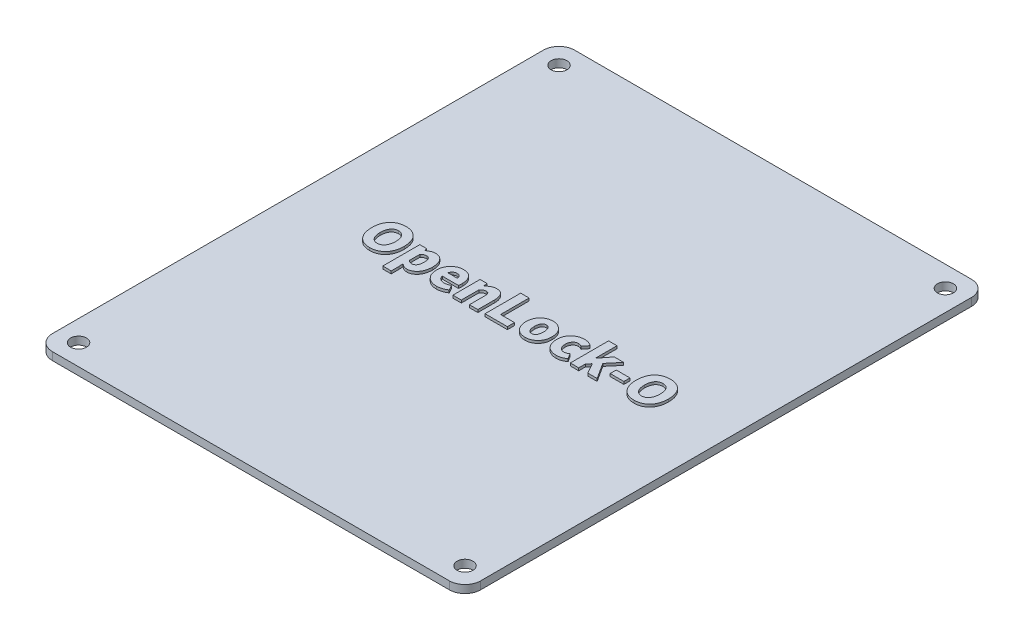
from build123d import *

# Parameters (mm, degrees)
SKETCH_1_W      = 82
SKETCH_1_H      = 100
SKETCH_1_R      = 1.525
EXTRUDE_1_DEPTH = 1.5
SKETCH_2_W      = 2.623961311
SKETCH_2_H      = 1.170362286
EXTRUDE_2_DEPTH = 0.5
FILLET_1_R      = 3


with BuildPart() as part:
    # 草图1 → 凸台-拉伸1 (new body)
    with BuildSketch(Plane(origin=(0, 0, 0), x_dir=(1, 0, 0), z_dir=(0, 1, 0))):
        with Locations((41, -50)):
            Rectangle(SKETCH_1_W, SKETCH_1_H)
        with Locations(Location((78, -4, 0), (0, 0, 270))):
            Circle(SKETCH_1_R, mode=Mode.SUBTRACT)
        with Locations(Location((4, -4, 0), (0, 0, 270))):
            Circle(SKETCH_1_R, mode=Mode.SUBTRACT)
        with Locations(Location((4, -96, 0), (0, 0, 270))):
            Circle(SKETCH_1_R, mode=Mode.SUBTRACT)
        with Locations(Location((78, -96, 0), (0, 0, 270))):
            Circle(SKETCH_1_R, mode=Mode.SUBTRACT)
    extrude(amount=EXTRUDE_1_DEPTH)

    # 草图2 → 凸台-拉伸2 (add)
    # profile 1 of 10: a face of its own
    with BuildSketch(Plane(origin=(0, 1.5, 0), x_dir=(1, 0, 0), z_dir=(0, 1, 0))):
        with BuildLine():
            add(Edge.make_bspline(
                [(16.597531244, -52.868504696), (16.714143345, -52.864361155), (16.942726236, -52.856238992), (17.275370336, -52.808965248), (17.589702335, -52.734304407), (17.885026024, -52.630618307), (18.160325946, -52.494980051), (18.418914493, -52.335556389), (18.655600222, -52.142759502), (18.873261107, -51.924148646), (19.068114571, -51.679209336), (19.238948607, -51.411578768), (19.383528015, -51.121239837), (19.502193704, -50.808702049), (19.595657136, -50.474187206), (19.663502929, -50.11760401), (19.704634315, -49.738677208), (19.712469256, -49.478656133), (19.716484597, -49.345397497)],
                knots=[0, 0, 0, 0, 1.05465202, 2.067327541, 3.032428974, 3.972491955, 4.891096316, 5.802957447, 6.713715081, 7.644945694, 8.587773863, 9.538525278, 10.511118449, 11.515624505, 12.557315148, 13.648110402, 14.794676162, 16, 16, 16, 16], degree=3))
            add(Edge.make_bspline(
                [(19.716484597, -49.345397497), (19.712509077, -49.21257955), (19.704778914, -48.954322999), (19.663352207, -48.578096697), (19.595879049, -48.224980662), (19.502127894, -47.894084131), (19.38384762, -47.585784092), (19.238822569, -47.300506498), (19.068410927, -47.038308031), (18.873101319, -46.799845129), (18.655121937, -46.587813456), (18.418310651, -46.400732379), (18.160584927, -46.244722235), (17.884169592, -46.115571579), (17.589674812, -46.013633924), (17.275093378, -45.942401469), (16.942469396, -45.895885552), (16.713696689, -45.888735374), (16.596858011, -45.885083639)],
                knots=[0, 0, 0, 0, 1.211229518, 2.355163325, 3.446999469, 4.485577954, 5.487016047, 6.45314753, 7.398105733, 8.332941379, 9.257579319, 10.165753545, 11.078753583, 11.997945354, 12.943095481, 13.914308117, 14.934796524, 16, 16, 16, 16], degree=3))
            add(Edge.make_bspline(
                [(16.596858011, -45.885083639), (16.480043441, -45.888880754), (16.252260152, -45.896284962), (15.919694191, -45.94057514), (15.606596769, -46.014010129), (15.311694106, -46.114240078), (15.03610472, -46.242538299), (14.780834839, -46.400913786), (14.542088581, -46.583924843), (14.32669681, -46.797844958), (14.129891678, -47.033845874), (13.962005671, -47.297067037), (13.816112702, -47.581394203), (13.699770938, -47.89079444), (13.605953905, -48.22187404), (13.538256519, -48.575860006), (13.496977234, -48.952992689), (13.489231024, -49.212135368), (13.485247595, -49.345397497)],
                knots=[0, 0, 0, 0, 1.066056328, 2.078763097, 3.055634584, 3.996376676, 4.916304394, 5.823104597, 6.732714334, 7.65518785, 8.58763338, 9.531136451, 10.498041464, 11.498821944, 12.542141308, 13.634851627, 14.783740645, 16, 16, 16, 16], degree=3))
            add(Edge.make_bspline(
                [(13.485247595, -49.345397497), (13.489259396, -49.478657542), (13.497087427, -49.738681367), (13.538267905, -50.117588633), (13.605940374, -50.474240802), (13.699966928, -50.808362107), (13.81641854, -51.121609118), (13.961821636, -51.411075622), (14.130630075, -51.679722437), (14.326017567, -51.923503608), (14.542077279, -52.143819205), (14.779799048, -52.334150428), (15.036360247, -52.495909528), (15.31113974, -52.630114029), (15.606053308, -52.734880558), (15.919798062, -52.808409731), (16.252057495, -52.856516232), (16.480008537, -52.864441924), (16.597531244, -52.868504696)],
                knots=[0, 0, 0, 0, 1.206525496, 2.354234335, 3.446117067, 4.488846234, 5.492922286, 6.466485093, 7.416021675, 8.359789805, 9.28911132, 10.203917972, 11.109861039, 12.029381212, 12.966582716, 13.936566544, 14.94226799, 16, 16, 16, 16], degree=3))
        make_face()
        with BuildLine():
            add(Edge.make_bspline(
                [(16.597531244, -51.44162624), (16.540160998, -51.439525749), (16.427991061, -51.435418883), (16.265631292, -51.404756325), (16.113284985, -51.359293865), (15.969760107, -51.29799214), (15.837271664, -51.216594997), (15.713138647, -51.119769236), (15.598988196, -51.005494071), (15.496630017, -50.873772074), (15.404287414, -50.727980222), (15.324484943, -50.568399029), (15.255713598, -50.395997599), (15.200578025, -50.210686758), (15.156127637, -50.012533335), (15.12434272, -49.801835802), (15.106108081, -49.577734241), (15.102407463, -49.424255453), (15.100506072, -49.345397497)],
                knots=[0, 0, 0, 0, 0.952337426, 1.862004026, 2.734839039, 3.589527261, 4.445782341, 5.309892407, 6.199028993, 7.120883171, 8.075078566, 9.060831922, 10.079986027, 11.154028263, 12.268395546, 13.450470468, 14.690042507, 16, 16, 16, 16], degree=3))
            add(Edge.make_bspline(
                [(15.100506072, -49.345397497), (15.102410881, -49.266987077), (15.106106825, -49.114845587), (15.124142818, -48.89336284), (15.156586741, -48.685473347), (15.199621794, -48.490939988), (15.25633729, -48.310071703), (15.324153148, -48.142654393), (15.404017781, -47.988302069), (15.496679402, -47.848874798), (15.599432938, -47.723642503), (15.713708405, -47.615062573), (15.836957345, -47.521800715), (15.970697162, -47.446654461), (16.113331597, -47.38743339), (16.26580825, -47.344809309), (16.427976812, -47.317247406), (16.53974005, -47.31374966), (16.596858011, -47.311962095)],
                knots=[0, 0, 0, 0, 1.324004878, 2.568996251, 3.748233199, 4.873607961, 5.929399441, 6.94440958, 7.91962876, 8.857982539, 9.765748034, 10.64851045, 11.513124996, 12.368273394, 13.231153703, 14.114140207, 15.036208426, 16, 16, 16, 16], degree=3))
            add(Edge.make_bspline(
                [(16.596858011, -47.311962095), (16.653977669, -47.313741255), (16.765744227, -47.317222554), (16.928312804, -47.344974398), (17.081670889, -47.38746402), (17.225391062, -47.446321733), (17.359400334, -47.521848107), (17.482742479, -47.615002712), (17.59693391, -47.724037386), (17.701106615, -47.84875348), (17.794907431, -47.988297207), (17.876591117, -48.142266117), (17.943599851, -48.310377053), (18.002554181, -48.490647038), (18.045112151, -48.685510883), (18.077190413, -48.893427006), (18.097434663, -49.114767657), (18.100818592, -49.266973832), (18.102562149, -49.345397497)],
                knots=[0, 0, 0, 0, 0.962011429, 1.882376567, 2.770955087, 3.639177498, 4.492746418, 5.355764002, 6.236895936, 7.147789007, 8.08857927, 9.065491182, 10.078626575, 11.134736751, 12.258032921, 13.435091792, 14.678440589, 16, 16, 16, 16], degree=3))
            add(Edge.make_bspline(
                [(18.102562149, -49.345397497), (18.100820537, -49.424268468), (18.097430041, -49.57781111), (18.076985613, -49.801771472), (18.045573265, -50.012498062), (18.001588422, -50.210966464), (17.944221294, -50.395701967), (17.876264506, -50.568777536), (17.794635156, -50.727980266), (17.701163321, -50.873894082), (17.597359073, -51.005103448), (17.483313901, -51.11982789), (17.359084693, -51.216547175), (17.226342131, -51.298339992), (17.081714611, -51.3592633), (16.928483535, -51.404579305), (16.765951788, -51.435401327), (16.654004764, -51.439522475), (16.597531244, -51.44162624)],
                knots=[0, 0, 0, 0, 1.307924065, 2.546210755, 3.726450759, 4.839088226, 5.913622602, 6.931194688, 7.918764782, 8.875449427, 9.800453563, 10.688209955, 11.550978676, 12.405904603, 13.266045869, 14.144600545, 15.052855082, 16, 16, 16, 16], degree=3))
        make_face(mode=Mode.SUBTRACT)
    # profile 2 of 10: a face of its own
    with BuildSketch(Plane(origin=(0, 1.5, 0), x_dir=(1, 0, 0), z_dir=(0, 1, 0))):
        with BuildLine():
            Line((20.9255891, -54.672144498), (22.539512853, -54.672144498))
            Line((22.539512853, -54.672144498), (22.539512853, -53.151776664))
            Line((22.539512853, -53.151776664), (22.485021417, -52.327105234))
            add(Edge.make_bspline(
                [(22.485021417, -52.327105234), (22.530979605, -52.369890065), (22.621160552, -52.453844127), (22.766001077, -52.563530263), (22.915310785, -52.656701193), (23.069337675, -52.732975697), (23.228062315, -52.793731126), (23.39134572, -52.837977079), (23.559348262, -52.865249693), (23.672812583, -52.870081262), (23.729914262, -52.872512781)],
                knots=[0, 0, 0, 0, 1.080819245, 2.120825615, 3.123218811, 4.10761128, 5.076191243, 6.04549969, 7.016384644, 8, 8, 8, 8], degree=3))
            add(Edge.make_bspline(
                [(23.729914262, -52.872512781), (23.800878877, -52.869726108), (23.941048596, -52.864221855), (24.14686745, -52.827012759), (24.34531306, -52.767655141), (24.536236739, -52.68608958), (24.720229034, -52.582065516), (24.895022561, -52.454241453), (25.062951342, -52.304568651), (25.22253035, -52.134465887), (25.370214562, -51.943664844), (25.498428607, -51.731298402), (25.607788759, -51.499966714), (25.700525584, -51.250841904), (25.772245198, -50.981829243), (25.824455603, -50.694012596), (25.861905283, -50.387526147), (25.869172789, -50.176521107), (25.872904003, -50.068188925)],
                knots=[0, 0, 0, 0, 0.867524246, 1.713538924, 2.549096929, 3.395672208, 4.246701567, 5.1278759, 6.038181227, 6.993591226, 7.976008708, 8.982739347, 10.02033566, 11.100620423, 12.228692567, 13.419536219, 14.675163049, 16, 16, 16, 16], degree=3))
            add(Edge.make_bspline(
                [(25.872904003, -50.068188925), (25.870412402, -49.971502122), (25.865569925, -49.783589402), (25.840718084, -49.509354766), (25.797447489, -49.251574831), (25.741303693, -49.008442153), (25.665694196, -48.781660005), (25.57569493, -48.570048526), (25.467767681, -48.374757519), (25.345380989, -48.196054635), (25.209348742, -48.034744785), (25.058813442, -47.894470577), (24.894436632, -47.776533495), (24.718614895, -47.677965071), (24.529457964, -47.601578886), (24.328322976, -47.545577783), (24.114137448, -47.50999834), (23.96697663, -47.504496964), (23.891573712, -47.501678144)],
                knots=[0, 0, 0, 0, 1.272678031, 2.473474996, 3.620070239, 4.710417113, 5.753870283, 6.762012236, 7.73260534, 8.685248579, 9.608297554, 10.504075368, 11.385706603, 12.264645351, 13.150571421, 14.063517403, 15.0077764, 16, 16, 16, 16], degree=3))
            add(Edge.make_bspline(
                [(23.891573712, -47.501678144), (23.821983793, -47.504280809), (23.683422313, -47.509463012), (23.478225884, -47.542218846), (23.278200948, -47.595871965), (23.084448106, -47.670415152), (22.897243961, -47.759606954), (22.71720087, -47.861647798), (22.545196834, -47.976311477), (22.438207152, -48.063273), (22.384533545, -48.106899062)],
                knots=[0, 0, 0, 0, 1.008046353, 2.007135434, 3.0023849, 4.002826844, 5.009902542, 6.003708328, 6.998518635, 8, 8, 8, 8], degree=3))
            Line((22.384533545, -48.106899062), (22.358090879, -48.105602175))
            Line((22.358090879, -48.105602175), (22.240226809, -47.58584794))
            Line((22.240226809, -47.58584794), (20.9255891, -47.58584794))
            Line((20.9255891, -47.58584794), (20.9255891, -54.672144498))
        make_face()
        with BuildLine():
            add(Edge.make_bspline(
                [(23.333755712, -51.523679788), (23.301010071, -51.524744686), (23.235096165, -51.526888224), (23.136275514, -51.515389051), (23.037424366, -51.493689081), (22.938222709, -51.461167657), (22.837955286, -51.418486524), (22.738048048, -51.364268243), (22.636587414, -51.301855815), (22.572468456, -51.252099301), (22.539512853, -51.226525649)],
                knots=[0, 0, 0, 0, 0.905667419, 1.823023605, 2.744097981, 3.702908016, 4.707896946, 5.75551274, 6.846387504, 8, 8, 8, 8], degree=3))
            Line((22.539512853, -51.226525649), (22.539512853, -49.199005826))
            add(Edge.make_bspline(
                [(22.539512853, -49.199005826), (22.572773243, -49.164792007), (22.637334213, -49.098380358), (22.741399797, -49.011576384), (22.844949437, -48.93591118), (22.95100915, -48.875012367), (23.059076362, -48.829762482), (23.167442002, -48.795316173), (23.278093215, -48.776195737), (23.352195798, -48.774449791), (23.38922699, -48.773577292)],
                knots=[0, 0, 0, 0, 1.169019233, 2.269156072, 3.31747539, 4.31007895, 5.259096192, 6.184586201, 7.092785528, 8, 8, 8, 8], degree=3))
            add(Edge.make_bspline(
                [(23.38922699, -48.773577292), (23.424895805, -48.774225823), (23.494276368, -48.775487301), (23.59474363, -48.788703461), (23.688526673, -48.812352867), (23.774233436, -48.84928096), (23.854105713, -48.894765033), (23.926923229, -48.951100223), (23.991305834, -49.019573238), (24.050731402, -49.096819515), (24.100681893, -49.186030162), (24.145991113, -49.284327449), (24.180290047, -49.39434818), (24.212324336, -49.513884808), (24.233765447, -49.644614189), (24.249774929, -49.785497881), (24.259521132, -49.936676768), (24.259165357, -50.041008951), (24.258981554, -50.094909495)],
                knots=[0, 0, 0, 0, 0.949516528, 1.846935277, 2.692706436, 3.516571434, 4.324226536, 5.135617785, 5.957687961, 6.821154133, 7.724432043, 8.674615029, 9.698551362, 10.788825593, 11.968525099, 13.221996814, 14.564815966, 16, 16, 16, 16], degree=3))
            add(Edge.make_bspline(
                [(24.258981554, -50.094909495), (24.257225396, -50.156381775), (24.253849123, -50.274564262), (24.241395922, -50.445577368), (24.21796928, -50.602821301), (24.190041376, -50.748005172), (24.150636588, -50.878996607), (24.105917691, -50.997557377), (24.052480004, -51.102634061), (23.99069483, -51.194441921), (23.921872991, -51.272675674), (23.851000514, -51.342473011), (23.774555323, -51.399474035), (23.694830625, -51.447417238), (23.610457355, -51.483912736), (23.521150764, -51.50719503), (23.428535809, -51.522949471), (23.365246815, -51.52395134), (23.333113792, -51.524460008)],
                knots=[0, 0, 0, 0, 1.543295769, 2.967037079, 4.299417015, 5.531209635, 6.673402462, 7.727741312, 8.707409226, 9.624928412, 10.496510736, 11.318533489, 12.116500839, 12.883175602, 13.649198431, 14.413752374, 15.194632004, 16, 16, 16, 16], degree=3))
            Line((23.333113792, -51.524460008), (23.333755712, -51.523679788))
        make_face(mode=Mode.SUBTRACT)
    # profile 3 of 10: a face of its own
    with BuildSketch(Plane(origin=(0, 1.5, 0), x_dir=(1, 0, 0), z_dir=(0, 1, 0))):
        with BuildLine():
            add(Edge.make_bspline(
                [(29.400573791, -52.868536009), (29.478416697, -52.866798654), (29.635722314, -52.863287791), (29.872647958, -52.832117826), (30.11236375, -52.783978657), (30.352792601, -52.717664307), (30.589359165, -52.633002206), (30.817371031, -52.529298794), (31.036479165, -52.409598224), (31.173670808, -52.315680062), (31.242402612, -52.268627892)],
                knots=[0, 0, 0, 0, 0.949363525, 1.91848201, 2.910541743, 3.930827625, 4.958594776, 5.972611383, 6.984296177, 8, 8, 8, 8], degree=3))
            Line((31.242402612, -52.268627892), (30.739934551, -51.304824226))
            add(Edge.make_bspline(
                [(30.739934551, -51.304824226), (30.647441805, -51.351785154), (30.467454154, -51.443169479), (30.185706948, -51.54013899), (29.904020848, -51.600093492), (29.715157853, -51.60848824), (29.621800021, -51.61263789)],
                knots=[0, 0, 0, 0, 1.061643805, 2.065921734, 3.043955894, 4, 4, 4, 4], degree=3))
            add(Edge.make_bspline(
                [(29.621800021, -51.61263789), (29.54950802, -51.61202599), (29.407054294, -51.61082022), (29.197334805, -51.573264489), (28.997786265, -51.508394571), (28.83847157, -51.434354065), (28.721406379, -51.355792577), (28.637380959, -51.288095305), (28.562690324, -51.206654313), (28.494703584, -51.115511374), (28.432388421, -51.014285397), (28.378242451, -50.901660887), (28.329748851, -50.77844886), (28.304239988, -50.691450256), (28.291115618, -50.646689272)],
                knots=[0, 0, 0, 0, 1.44726418, 2.851880876, 4.249415211, 5.646949545, 6.355106443, 7.071821608, 7.804538447, 8.563385163, 9.348862513, 10.183343221, 11.065325871, 12, 12, 12, 12], degree=3))
            Line((28.291115618, -50.646689272), (31.360209275, -50.645354549))
            add(Edge.make_bspline(
                [(31.360209275, -50.645354549), (31.364709113, -50.626677913), (31.374630648, -50.585498456), (31.387808245, -50.517807929), (31.399731971, -50.438460561), (31.413892874, -50.314733559), (31.428202392, -50.144644531), (31.42990171, -50.004542546), (31.430782633, -49.931914016)],
                knots=[0, 0, 0, 0, 0.481247852, 1.061086476, 1.726960091, 2.490863857, 4.180872323, 6, 6, 6, 6], degree=3))
            add(Edge.make_bspline(
                [(31.430782633, -49.931914016), (31.42939768, -49.848570712), (31.426680263, -49.685042694), (31.400717847, -49.444676097), (31.357798546, -49.214811527), (31.300271654, -48.994611417), (31.221130863, -48.786616177), (31.128095155, -48.587284231), (31.015430898, -48.399427206), (30.887375206, -48.222296749), (30.7422378, -48.05957152), (30.57693406, -47.917246869), (30.393361837, -47.796479987), (30.192814095, -47.695204056), (29.973487278, -47.617187339), (29.736883966, -47.558162167), (29.482169956, -47.520932482), (29.306173966, -47.512629216), (29.215647352, -47.508358286)],
                knots=[0, 0, 0, 0, 1.079232204, 2.11756307, 3.126740041, 4.106201248, 5.060837545, 6.005223805, 6.951950163, 7.893442881, 8.832848148, 9.769468829, 10.710183717, 11.672405636, 12.67234138, 13.718811886, 14.82663102, 16, 16, 16, 16], degree=3))
            add(Edge.make_bspline(
                [(29.215647352, -47.508358286), (29.134463352, -47.511689088), (28.974438058, -47.518254575), (28.738508936, -47.555234336), (28.510862837, -47.61416983), (28.290634182, -47.694604705), (28.078429014, -47.797177241), (27.873560414, -47.919944253), (27.67737894, -48.066092737), (27.490201272, -48.231176177), (27.318436407, -48.41617158), (27.165814604, -48.617990459), (27.036448491, -48.836033788), (26.928987472, -49.069989584), (26.841341123, -49.318316947), (26.780226569, -49.583822546), (26.735634386, -49.86372501), (26.726139836, -50.056434327), (26.721282111, -50.155030778)],
                knots=[0, 0, 0, 0, 0.964800247, 1.90175952, 2.8309468, 3.754997237, 4.682736995, 5.627419143, 6.588366425, 7.585435191, 8.588886157, 9.582621669, 10.586295836, 11.594854022, 12.637429717, 13.709100714, 14.827900274, 16, 16, 16, 16], degree=3))
            add(Edge.make_bspline(
                [(26.721282111, -50.155030778), (26.725319041, -50.259373921), (26.733180604, -50.462572906), (26.773851569, -50.757632602), (26.836278313, -51.034549101), (26.921672164, -51.29391614), (27.03059408, -51.535372019), (27.159920423, -51.760570995), (27.314762556, -51.965652129), (27.490587516, -52.151220499), (27.682220358, -52.318205672), (27.889410402, -52.463209211), (28.109621879, -52.586686014), (28.342686638, -52.688575796), (28.589030342, -52.767525495), (28.847994118, -52.824510142), (29.119731555, -52.861720649), (29.305484198, -52.867101996), (29.400019287, -52.869840724)],
                knots=[0, 0, 0, 0, 1.169002523, 2.276528382, 3.330470668, 4.344713422, 5.329280848, 6.29260664, 7.24731909, 8.200048858, 9.151197353, 10.089427384, 11.027392192, 11.974490578, 12.933571255, 13.919868197, 14.941358559, 16, 16, 16, 16], degree=3))
            Line((29.400019287, -52.869840724), (29.400573791, -52.868536009))
        make_face()
        with BuildLine():
            add(Edge.make_bspline(
                [(28.283165988, -49.560498088), (28.303230868, -49.491984153), (28.341299099, -49.36199562), (28.429416906, -49.188773407), (28.535155833, -49.04470408), (28.664609831, -48.937942724), (28.803473339, -48.859578993), (28.946124176, -48.80220343), (29.093370088, -48.768527692), (29.19276874, -48.766548648), (29.242367922, -48.765561121)],
                knots=[0, 0, 0, 0, 1.262493809, 2.395275001, 3.425824592, 4.4058338, 5.34247459, 6.242157035, 7.122849544, 8, 8, 8, 8], degree=3))
            add(Edge.make_bspline(
                [(29.242367922, -48.765561121), (29.278459091, -48.766957813), (29.347674194, -48.769636369), (29.447926993, -48.779693285), (29.539956817, -48.798546832), (29.62469415, -48.823561124), (29.70103083, -48.855915113), (29.770636527, -48.893410383), (29.83225446, -48.938431929), (29.901248303, -49.009035918), (29.974341044, -49.108208956), (30.034211051, -49.245615478), (30.070167388, -49.398319553), (30.07228042, -49.505067029), (30.07337766, -49.560498088)],
                knots=[0, 0, 0, 0, 0.990336762, 1.899252999, 2.759015381, 3.562565422, 4.317804928, 5.028279135, 5.726793959, 6.400310994, 7.729065746, 9.079306386, 10.483363283, 12, 12, 12, 12], degree=3))
            Line((30.07337766, -49.560498088), (28.283165988, -49.560498088))
        make_face(mode=Mode.SUBTRACT)
    # profile 4 of 10: a face of its own
    with BuildSketch(Plane(origin=(0, 1.5, 0), x_dir=(1, 0, 0), z_dir=(0, 1, 0))):
        with BuildLine():
            Line((32.468875485, -52.791016347), (34.082799238, -52.791016347))
            Line((34.082799238, -52.791016347), (34.082799238, -49.391371752))
            add(Edge.make_bspline(
                [(34.082799238, -49.391371752), (34.120811872, -49.356579393), (34.194536646, -49.289100279), (34.305664085, -49.196844617), (34.415075211, -49.119050048), (34.521047662, -49.051381756), (34.631875264, -48.998644519), (34.750476496, -48.963622526), (34.876753303, -48.93937691), (34.964011903, -48.937522021), (35.008667, -48.936572771)],
                knots=[0, 0, 0, 0, 1.165579364, 2.260618836, 3.264174379, 4.200621562, 5.101895524, 6.029141078, 6.991401432, 8, 8, 8, 8], degree=3))
            add(Edge.make_bspline(
                [(35.008667, -48.936572771), (35.058299392, -48.937177914), (35.15222409, -48.938323092), (35.283842713, -48.97180928), (35.395500265, -49.032004722), (35.469924815, -49.105595162), (35.517387114, -49.177858284), (35.547602643, -49.242988651), (35.574981209, -49.317363596), (35.595517559, -49.402608563), (35.611011275, -49.497798174), (35.623376408, -49.602526041), (35.629472555, -49.717632331), (35.630644632, -49.797860409), (35.631256289, -49.839728048)],
                knots=[0, 0, 0, 0, 1.403580501, 2.656145923, 3.808961022, 4.960738452, 5.580592332, 6.252646208, 6.991589465, 7.824551574, 8.73374269, 9.725139103, 10.812846341, 12, 12, 12, 12], degree=3))
            Line((35.631256289, -49.839728048), (35.632589708, -52.791016347))
            Line((35.632589708, -52.791016347), (37.246513461, -52.791016347))
            Line((37.246513461, -52.791016347), (37.246513461, -49.64187188))
            add(Edge.make_bspline(
                [(37.246513461, -49.64187188), (37.244905553, -49.562178851), (37.241766586, -49.406601652), (37.226838604, -49.179411547), (37.197276039, -48.96522651), (37.156130464, -48.764283894), (37.103128616, -48.575837803), (37.03584571, -48.401106679), (36.959014745, -48.237838601), (36.867682378, -48.089452421), (36.765303035, -47.954140988), (36.646505497, -47.836785609), (36.513130091, -47.737598243), (36.36625534, -47.654727093), (36.204172924, -47.593006908), (36.029410579, -47.545329285), (35.839609587, -47.517991814), (35.708382989, -47.512520223), (35.640608489, -47.509694315)],
                knots=[0, 0, 0, 0, 1.260933832, 2.461602438, 3.599444639, 4.678560811, 5.70436123, 6.692226558, 7.63757411, 8.554672072, 9.443851072, 10.315667569, 11.186458667, 12.066463542, 12.974423475, 13.922916079, 14.927250078, 16, 16, 16, 16], degree=3))
            add(Edge.make_bspline(
                [(35.640608489, -47.509694315), (35.552665938, -47.513884065), (35.380527847, -47.522085049), (35.130396697, -47.568813429), (34.894247551, -47.640154765), (34.67510029, -47.741965294), (34.470783337, -47.864044175), (34.276678985, -47.996891045), (34.094951094, -48.144583672), (33.983592536, -48.253002875), (33.92781993, -48.30730334)],
                knots=[0, 0, 0, 0, 1.087709998, 2.129075413, 3.137726551, 4.130922467, 5.108542943, 6.0786259, 7.037702697, 8, 8, 8, 8], degree=3))
            Line((33.92781993, -48.30730334), (33.901377264, -48.306281747))
            Line((33.901377264, -48.306281747), (33.783513194, -47.58584794))
            Line((33.783513194, -47.58584794), (32.468875485, -47.58584794))
            Line((32.468875485, -47.58584794), (32.468875485, -52.791016347))
        make_face()
    # profile 5 of 10: a face of its own
    with BuildSketch(Plane(origin=(0, 1.5, 0), x_dir=(1, 0, 0), z_dir=(0, 1, 0))):
        Polygon((38.625294891, -52.791015042), (42.917303462, -52.791015042), (42.917303462, -51.433610069), (40.239218644, -51.433610069), (40.239218644, -45.961238569), (38.625294891, -45.961238569), align=None)
    # profile 6 of 10: a face of its own
    with BuildSketch(Plane(origin=(0, 1.5, 0), x_dir=(1, 0, 0), z_dir=(0, 1, 0))):
        with BuildLine():
            add(Edge.make_bspline(
                [(46.362870123, -52.876520867), (46.446973099, -52.874281083), (46.612557499, -52.86987133), (46.855747023, -52.832819004), (47.090416821, -52.779902941), (47.314619526, -52.700331112), (47.531074615, -52.604048845), (47.735844717, -52.481483102), (47.933619364, -52.341720893), (48.118574128, -52.178388811), (48.290023336, -51.996417626), (48.440480861, -51.793469698), (48.568168498, -51.570880396), (48.673243234, -51.329556562), (48.757847722, -51.06964302), (48.81999356, -50.791434823), (48.860494095, -50.494153067), (48.869392234, -50.289652982), (48.873970948, -50.184423406)],
                knots=[0, 0, 0, 0, 0.978512426, 1.926523886, 2.858364272, 3.774892385, 4.691376507, 5.611650703, 6.54820959, 7.507046474, 8.479079749, 9.453763952, 10.440847561, 11.459964718, 12.512516309, 13.618062107, 14.774326603, 16, 16, 16, 16], degree=3))
            add(Edge.make_bspline(
                [(48.873970948, -50.184423406), (48.86939245, -50.079638884), (48.860495688, -49.876025588), (48.820002633, -49.580069544), (48.757832123, -49.303205767), (48.673312898, -49.044566588), (48.567755078, -48.804413427), (48.440967684, -48.582136413), (48.289453491, -48.380468159), (48.119177834, -48.198221704), (47.932617334, -48.036893135), (47.736821754, -47.894739698), (47.530196992, -47.774949099), (47.315336661, -47.675691372), (47.090053176, -47.598845877), (46.855807818, -47.545221035), (46.612332715, -47.508336704), (46.446546532, -47.503922799), (46.362237336, -47.501678144)],
                knots=[0, 0, 0, 0, 1.222736421, 2.375974912, 3.478482595, 4.528028199, 5.544260463, 6.53315431, 7.505459279, 8.479275191, 9.436452288, 10.377757152, 11.297096539, 12.217418416, 13.133936475, 14.067485788, 15.017235832, 16, 16, 16, 16], degree=3))
            add(Edge.make_bspline(
                [(46.362237336, -47.501678144), (46.277484267, -47.503924703), (46.110814299, -47.508342644), (45.86599774, -47.545205044), (45.630460196, -47.598903775), (45.404098557, -47.675335749), (45.188736344, -47.775379735), (44.981109513, -47.894235624), (44.785143127, -48.037390734), (44.597320788, -48.197735372), (44.426965305, -48.380480259), (44.275707554, -48.582508324), (44.147084198, -48.803998452), (44.041940259, -49.044629165), (43.957149685, -49.303173529), (43.895561848, -49.580196098), (43.852814167, -49.875896964), (43.844231188, -50.079615954), (43.839815496, -50.184423406)],
                knots=[0, 0, 0, 0, 0.985978059, 1.938961419, 2.875692889, 3.795286697, 4.713769531, 5.635756143, 6.575180033, 7.534360194, 8.506230167, 9.476592217, 10.466106599, 11.480308165, 12.527756503, 13.628061088, 14.779706926, 16, 16, 16, 16], degree=3))
            add(Edge.make_bspline(
                [(43.839815496, -50.184423406), (43.844231421, -50.289675809), (43.852815755, -50.494281122), (43.895571229, -50.791308753), (43.95713386, -51.069675296), (44.042010547, -51.329493643), (44.146668682, -51.571296572), (44.276196526, -51.793096316), (44.426396209, -51.996405211), (44.597922613, -52.178873498), (44.784141898, -52.341226879), (44.982085289, -52.481984481), (45.187860508, -52.603620541), (45.404814286, -52.700685691), (45.630097511, -52.779847321), (45.86605843, -52.832834234), (46.1107984, -52.869898214), (46.277478907, -52.874288414), (46.362870123, -52.876520867)],
                knots=[0, 0, 0, 0, 1.223044497, 2.377536223, 3.480710779, 4.531004793, 5.547936085, 6.535494004, 7.508087645, 8.478036043, 9.438710516, 10.373260614, 11.296023719, 12.210542111, 13.129992916, 14.064872285, 15.015971412, 16, 16, 16, 16], degree=3))
        make_face()
        with BuildLine():
            add(Edge.make_bspline(
                [(46.362870123, -51.604621719), (46.324721173, -51.602812051), (46.251289439, -51.599328678), (46.144726494, -51.580119045), (46.046308379, -51.549886432), (45.955076681, -51.507704309), (45.871536911, -51.454607406), (45.79742034, -51.386917741), (45.728971495, -51.310229966), (45.670410115, -51.220340932), (45.618510331, -51.121940033), (45.574469088, -51.013912428), (45.537133386, -50.89730163), (45.506754324, -50.771775082), (45.482789629, -50.637479664), (45.465291702, -50.494344479), (45.456333295, -50.342193987), (45.455500622, -50.237874934), (45.455073973, -50.184423406)],
                knots=[0, 0, 0, 0, 0.963941433, 1.855461068, 2.727242465, 3.557761025, 4.387822293, 5.21651017, 6.085383197, 6.977754197, 7.918791909, 8.892352547, 9.920540075, 11.009231951, 12.152307905, 13.364905709, 14.649816963, 16, 16, 16, 16], degree=3))
            add(Edge.make_bspline(
                [(45.455073973, -50.184423406), (45.455500633, -50.131417189), (45.456333159, -50.027987977), (45.465286138, -49.877169828), (45.482792701, -49.735370773), (45.506721071, -49.60239912), (45.537327222, -49.47782264), (45.574519597, -49.361649005), (45.618121929, -49.25381604), (45.670880829, -49.156353705), (45.728479597, -49.066655685), (45.797900886, -48.991258889), (45.87147517, -48.923538001), (45.955093217, -48.870508999), (46.046303712, -48.828308771), (46.144727772, -48.798080101), (46.251081485, -48.778911376), (46.324300148, -48.7753978), (46.362237336, -48.773577292)],
                knots=[0, 0, 0, 0, 1.345604455, 2.625631839, 3.833047409, 4.970692096, 6.053828503, 7.087137873, 8.065548233, 9.001286548, 9.898102829, 10.762845839, 11.595661765, 12.429857923, 13.264513651, 14.140637763, 15.03659844, 16, 16, 16, 16], degree=3))
            add(Edge.make_bspline(
                [(46.362237336, -48.773577292), (46.399269375, -48.775475017), (46.47156671, -48.77917993), (46.576350659, -48.797581704), (46.673478535, -48.828973587), (46.763892459, -48.870033012), (46.846377463, -48.924082511), (46.920014016, -48.990741836), (46.987734353, -49.067227302), (47.046016834, -49.155866959), (47.096334537, -49.254560186), (47.142475116, -49.361229133), (47.178857926, -49.477914681), (47.210213776, -49.602223713), (47.231818897, -49.73554342), (47.249987997, -49.877141947), (47.258748156, -50.027995543), (47.259607894, -50.131419753), (47.260048499, -50.184423406)],
                knots=[0, 0, 0, 0, 0.944623835, 1.844181136, 2.702168957, 3.540175215, 4.368204393, 5.204363464, 6.065050309, 6.96546665, 7.899665974, 8.88638837, 9.923845719, 11.011330124, 12.151565718, 13.363828175, 14.64899393, 16, 16, 16, 16], degree=3))
            add(Edge.make_bspline(
                [(47.260048499, -50.184423406), (47.259607919, -50.237872396), (47.258748057, -50.342186497), (47.249982397, -50.494372098), (47.23182153, -50.637308585), (47.210182111, -50.7719493), (47.17905149, -50.897209651), (47.142523645, -51.014330538), (47.09594099, -51.121199317), (47.046488253, -51.220822033), (46.987239061, -51.309664273), (46.920498421, -51.387430516), (46.846316337, -51.454064521), (46.763908973, -51.508180042), (46.673473978, -51.549221549), (46.57635195, -51.580618405), (46.471566362, -51.599018784), (46.399269256, -51.602723893), (46.362870123, -51.604621719)],
                knots=[0, 0, 0, 0, 1.356015766, 2.646477778, 3.864313948, 5.010380312, 6.103775286, 7.136404538, 8.118534946, 9.058423216, 9.954649218, 10.819856495, 11.652124266, 12.476299979, 13.310406341, 14.164401276, 15.059772236, 16, 16, 16, 16], degree=3))
        make_face(mode=Mode.SUBTRACT)
    # profile 7 of 10: a face of its own
    with BuildSketch(Plane(origin=(0, 1.5, 0), x_dir=(1, 0, 0), z_dir=(0, 1, 0))):
        with BuildLine():
            add(Edge.make_bspline(
                [(52.324627303, -52.876520867), (52.404110708, -52.874444283), (52.562229696, -52.870313265), (52.796765993, -52.837743832), (53.027099343, -52.789821813), (53.249580781, -52.71791807), (53.463157382, -52.630729799), (53.663698171, -52.525553505), (53.853123037, -52.407981008), (53.966555836, -52.314051679), (54.023024851, -52.267291863)],
                knots=[0, 0, 0, 0, 1.035336762, 2.059629965, 3.080613543, 4.097382841, 5.101788831, 6.082924094, 7.045642972, 8, 8, 8, 8], degree=3))
            Line((54.023024851, -52.267291863), (53.386626455, -51.283779168))
            add(Edge.make_bspline(
                [(53.386626455, -51.283779168), (53.352388955, -51.309283338), (53.284939833, -51.359527482), (53.179028462, -51.425315867), (53.070815651, -51.480267053), (52.959652814, -51.524447381), (52.846569088, -51.561114459), (52.730201225, -51.586240878), (52.611241268, -51.60133973), (52.531170621, -51.603518017), (52.490600143, -51.604621719)],
                knots=[0, 0, 0, 0, 1.056047964, 2.080452898, 3.080869373, 4.054901861, 5.037684156, 6.018982631, 6.996251116, 8, 8, 8, 8], degree=3))
            add(Edge.make_bspline(
                [(52.490600143, -51.604621719), (52.449561498, -51.60274009), (52.369298637, -51.599060023), (52.251835838, -51.580219254), (52.140871943, -51.549348287), (52.035306621, -51.507804943), (51.935873306, -51.453798321), (51.841900414, -51.388248263), (51.755044872, -51.310108295), (51.674587335, -51.221403847), (51.601491906, -51.123049067), (51.53695128, -51.015277387), (51.481636323, -50.898706942), (51.438768852, -50.77229608), (51.401431908, -50.63834345), (51.377599862, -50.494523916), (51.358948381, -50.342544368), (51.356320078, -50.237927098), (51.354975903, -50.184423406)],
                knots=[0, 0, 0, 0, 0.967519725, 1.892262816, 2.796107441, 3.676934939, 4.559698254, 5.456386629, 6.370589628, 7.306636836, 8.274213473, 9.253274597, 10.262576824, 11.308056568, 12.395057679, 13.535505222, 14.739600344, 16, 16, 16, 16], degree=3))
            add(Edge.make_bspline(
                [(51.354975903, -50.184423406), (51.356484056, -50.131383599), (51.359431102, -50.027739713), (51.375781701, -49.876877017), (51.400341093, -49.734558449), (51.436958849, -49.601557124), (51.482257465, -49.476743977), (51.536939944, -49.360293457), (51.601026597, -49.252229964), (51.676500126, -49.154997697), (51.758669068, -49.066618149), (51.849304198, -48.98961334), (51.946878602, -48.923927068), (52.051498268, -48.870410755), (52.162712102, -48.828619749), (52.280823405, -48.797692921), (52.406321255, -48.779273361), (52.492323633, -48.775496484), (52.536025112, -48.773577292)],
                knots=[0, 0, 0, 0, 1.229881608, 2.403283825, 3.515287334, 4.574900912, 5.597386342, 6.590511984, 7.553881213, 8.503931974, 9.438993645, 10.347332081, 11.25520085, 12.160364296, 13.065586639, 14.004801253, 14.986154341, 16, 16, 16, 16], degree=3))
            add(Edge.make_bspline(
                [(52.536025112, -48.773577292), (52.600472317, -48.777125047), (52.725245751, -48.783993703), (52.902812702, -48.830988331), (53.064674771, -48.903716963), (53.155869784, -48.975551735), (53.201367313, -49.011390368)],
                knots=[0, 0, 0, 0, 1.071534521, 2.074551428, 3.039386586, 4, 4, 4, 4], degree=3))
            Line((53.201367313, -49.011390368), (53.968417295, -48.039111271))
            add(Edge.make_bspline(
                [(53.968417295, -48.039111271), (53.919993419, -47.999447871), (53.822343574, -47.919464088), (53.662645255, -47.8129165), (53.48751094, -47.722990244), (53.300964813, -47.643452904), (53.101004637, -47.580741786), (52.889098445, -47.535174935), (52.665380865, -47.508845127), (52.512488956, -47.504099338), (52.434486945, -47.501678144)],
                knots=[0, 0, 0, 0, 0.904164879, 1.823306315, 2.767383419, 3.745010637, 4.750389761, 5.790387894, 6.87270562, 8, 8, 8, 8], degree=3))
            add(Edge.make_bspline(
                [(52.434486945, -47.501678144), (52.342621079, -47.503928944), (52.162225523, -47.508348804), (51.897807889, -47.544917912), (51.644162395, -47.598952803), (51.400846001, -47.674987254), (51.169384268, -47.774975396), (50.947062042, -47.893722402), (50.737726213, -48.036446924), (50.538978945, -48.19710693), (50.359349081, -48.380316056), (50.198340515, -48.581410481), (50.062994325, -48.803450284), (49.952746767, -49.044434899), (49.861784174, -49.302532243), (49.797963669, -49.58002504), (49.754060658, -49.87583866), (49.744589282, -50.079608791), (49.739717427, -50.184423406)],
                knots=[0, 0, 0, 0, 1.033326452, 2.029126887, 2.998305124, 3.94927728, 4.892227008, 5.831721402, 6.781041588, 7.739051988, 8.702929585, 9.662459224, 10.63194836, 11.620725557, 12.639809013, 13.705829454, 14.819932049, 16, 16, 16, 16], degree=3))
            add(Edge.make_bspline(
                [(49.739717427, -50.184423406), (49.743204519, -50.289670135), (49.749980811, -50.494190845), (49.790672104, -50.790985016), (49.847198959, -51.069766974), (49.930306843, -51.329023097), (50.030293532, -51.571182964), (50.156194692, -51.792463268), (50.300663232, -51.996677948), (50.468572745, -52.179014508), (50.652436401, -52.342287583), (50.852115958, -52.482894109), (51.063744449, -52.604883649), (51.290976876, -52.701110542), (51.529665091, -52.780187111), (51.782921673, -52.833469758), (52.048664881, -52.869843119), (52.230838346, -52.874267885), (52.323596578, -52.876520867)],
                knots=[0, 0, 0, 0, 1.200198759, 2.332286282, 3.412102103, 4.440150241, 5.432524932, 6.394514518, 7.337423147, 8.27936005, 9.214894099, 10.136551978, 11.060097198, 11.995107192, 12.945957363, 13.923257596, 14.94257403, 16, 16, 16, 16], degree=3))
            Line((52.323596578, -52.876520867), (52.324627303, -52.876520867))
        make_face()
    # profile 8 of 10: a face of its own
    with BuildSketch(Plane(origin=(0, 1.5, 0), x_dir=(1, 0, 0), z_dir=(0, 1, 0))):
        Polygon((54.95690748, -52.791016347), (56.570831233, -52.791016347), (56.570831233, -51.501238684), (57.180326398, -50.815186736), (58.316203752, -52.791016347), (60.098515373, -52.791016347), (58.140743023, -49.754093056), (59.96922852, -47.58584794), (58.168447349, -47.58584794), (56.617005109, -49.543703792), (56.570831233, -49.543703792), (56.570831233, -45.461849636), (54.95690748, -45.461849636), align=None)
    # profile 9 of 10: a face of its own
    with BuildSketch(Plane(origin=(0, 1.5, 0), x_dir=(1, 0, 0), z_dir=(0, 1, 0))):
        with Locations((61.834782937, -50.145679231)):
            Rectangle(SKETCH_2_W, SKETCH_2_H)
    # profile 10 of 10: a face of its own
    with BuildSketch(Plane(origin=(0, 1.5, 0), x_dir=(1, 0, 0), z_dir=(0, 1, 0))):
        with BuildLine():
            add(Edge.make_bspline(
                [(67.216979688, -52.868504696), (67.333591789, -52.864361155), (67.56217468, -52.856238992), (67.894818779, -52.808965248), (68.209150778, -52.734304407), (68.504474468, -52.630618307), (68.77977439, -52.494980051), (69.038362937, -52.335556389), (69.275048666, -52.142759502), (69.492709551, -51.924148646), (69.687563015, -51.679209336), (69.85839705, -51.411578768), (70.002976459, -51.121239837), (70.121642147, -50.808702049), (70.21510558, -50.474187206), (70.282951373, -50.11760401), (70.324082759, -49.738677208), (70.331917699, -49.478656133), (70.335933041, -49.345397497)],
                knots=[0, 0, 0, 0, 1.05465202, 2.067327541, 3.032428974, 3.972491955, 4.891096316, 5.802957447, 6.713715081, 7.644945694, 8.587773863, 9.538525278, 10.511118449, 11.515624505, 12.557315148, 13.648110402, 14.794676162, 16, 16, 16, 16], degree=3))
            add(Edge.make_bspline(
                [(70.335933041, -49.345397497), (70.33195752, -49.21257955), (70.324227358, -48.954322999), (70.28280065, -48.578096697), (70.215327492, -48.224980662), (70.121576337, -47.894084131), (70.003296064, -47.585784092), (69.858271013, -47.300506498), (69.68785937, -47.038308031), (69.492549763, -46.799845129), (69.274570381, -46.587813456), (69.037759094, -46.400732379), (68.780033371, -46.244722235), (68.503618036, -46.115571579), (68.209123256, -46.013633924), (67.894541821, -45.942401469), (67.561917839, -45.895885552), (67.333145133, -45.888735374), (67.216306454, -45.885083639)],
                knots=[0, 0, 0, 0, 1.211229518, 2.355163325, 3.446999469, 4.485577954, 5.487016047, 6.45314753, 7.398105733, 8.332941379, 9.257579319, 10.165753545, 11.078753583, 11.997945354, 12.943095481, 13.914308117, 14.934796524, 16, 16, 16, 16], degree=3))
            add(Edge.make_bspline(
                [(67.216306454, -45.885083639), (67.099491885, -45.888880754), (66.871708596, -45.896284962), (66.539142635, -45.94057514), (66.226045213, -46.014010129), (65.931142549, -46.114240078), (65.655553163, -46.242538299), (65.400283282, -46.400913786), (65.161537025, -46.583924843), (64.946145253, -46.797844958), (64.749340121, -47.033845874), (64.581454115, -47.297067037), (64.435561145, -47.581394203), (64.319219382, -47.89079444), (64.225402349, -48.22187404), (64.157704963, -48.575860006), (64.116425678, -48.952992689), (64.108679468, -49.212135368), (64.104696039, -49.345397497)],
                knots=[0, 0, 0, 0, 1.066056328, 2.078763097, 3.055634584, 3.996376676, 4.916304394, 5.823104597, 6.732714334, 7.65518785, 8.58763338, 9.531136451, 10.498041464, 11.498821944, 12.542141308, 13.634851627, 14.783740645, 16, 16, 16, 16], degree=3))
            add(Edge.make_bspline(
                [(64.104696039, -49.345397497), (64.10870784, -49.478657542), (64.116535871, -49.738681367), (64.157716349, -50.117588633), (64.225388817, -50.474240802), (64.319415372, -50.808362107), (64.435866983, -51.121609118), (64.581270079, -51.411075622), (64.750078519, -51.679722437), (64.94546601, -51.923503608), (65.161525723, -52.143819205), (65.399247492, -52.334150428), (65.65580869, -52.495909528), (65.930588184, -52.630114029), (66.225501752, -52.734880558), (66.539246505, -52.808409731), (66.871505938, -52.856516232), (67.09945698, -52.864441924), (67.216979688, -52.868504696)],
                knots=[0, 0, 0, 0, 1.206525496, 2.354234335, 3.446117067, 4.488846234, 5.492922286, 6.466485093, 7.416021675, 8.359789805, 9.28911132, 10.203917972, 11.109861039, 12.029381212, 12.966582716, 13.936566544, 14.94226799, 16, 16, 16, 16], degree=3))
        make_face()
        with BuildLine():
            add(Edge.make_bspline(
                [(67.216979688, -51.44162624), (67.159609442, -51.439525749), (67.047439505, -51.435418883), (66.885079736, -51.404756325), (66.732733429, -51.359293865), (66.589208551, -51.29799214), (66.456720108, -51.216594997), (66.332587091, -51.119769236), (66.218436639, -51.005494071), (66.116078461, -50.873772074), (66.023735858, -50.727980222), (65.943933387, -50.568399029), (65.875162041, -50.395997599), (65.820026468, -50.210686758), (65.775576081, -50.012533335), (65.743791164, -49.801835802), (65.725556525, -49.577734241), (65.721855907, -49.424255453), (65.719954516, -49.345397497)],
                knots=[0, 0, 0, 0, 0.952337426, 1.862004026, 2.734839039, 3.589527261, 4.445782341, 5.309892407, 6.199028993, 7.120883171, 8.075078566, 9.060831922, 10.079986027, 11.154028263, 12.268395546, 13.450470468, 14.690042507, 16, 16, 16, 16], degree=3))
            add(Edge.make_bspline(
                [(65.719954516, -49.345397497), (65.721859325, -49.266987077), (65.725555269, -49.114845587), (65.743591262, -48.89336284), (65.776035185, -48.685473347), (65.819070238, -48.490939988), (65.875785734, -48.310071703), (65.943601592, -48.142654393), (66.023466225, -47.988302069), (66.116127846, -47.848874798), (66.218881382, -47.723642503), (66.333156848, -47.615062573), (66.456405789, -47.521800715), (66.590145606, -47.446654461), (66.73278004, -47.38743339), (66.885256694, -47.344809309), (67.047425256, -47.317247406), (67.159188493, -47.31374966), (67.216306454, -47.311962095)],
                knots=[0, 0, 0, 0, 1.324004878, 2.568996251, 3.748233199, 4.873607961, 5.929399441, 6.94440958, 7.91962876, 8.857982539, 9.765748034, 10.64851045, 11.513124996, 12.368273394, 13.231153703, 14.114140207, 15.036208426, 16, 16, 16, 16], degree=3))
            add(Edge.make_bspline(
                [(67.216306454, -47.311962095), (67.273426113, -47.313741255), (67.385192671, -47.317222554), (67.547761248, -47.344974398), (67.701119333, -47.38746402), (67.844839505, -47.446321733), (67.978848778, -47.521848107), (68.102190923, -47.615002712), (68.216382354, -47.724037386), (68.320555059, -47.84875348), (68.414355875, -47.988297207), (68.496039561, -48.142266117), (68.563048294, -48.310377053), (68.622002625, -48.490647038), (68.664560595, -48.685510883), (68.696638857, -48.893427006), (68.716883107, -49.114767657), (68.720267036, -49.266973832), (68.722010593, -49.345397497)],
                knots=[0, 0, 0, 0, 0.962011429, 1.882376567, 2.770955087, 3.639177498, 4.492746418, 5.355764002, 6.236895936, 7.147789007, 8.08857927, 9.065491182, 10.078626575, 11.134736751, 12.258032921, 13.435091792, 14.678440589, 16, 16, 16, 16], degree=3))
            add(Edge.make_bspline(
                [(68.722010593, -49.345397497), (68.720268981, -49.424268468), (68.716878485, -49.57781111), (68.696434057, -49.801771472), (68.665021709, -50.012498062), (68.621036866, -50.210966464), (68.563669738, -50.395701967), (68.495712949, -50.568777536), (68.4140836, -50.727980266), (68.320611764, -50.873894082), (68.216807517, -51.005103448), (68.102762344, -51.11982789), (67.978533137, -51.216547175), (67.845790575, -51.298339992), (67.701163054, -51.3592633), (67.547931979, -51.404579305), (67.385400232, -51.435401327), (67.273453208, -51.439522475), (67.216979688, -51.44162624)],
                knots=[0, 0, 0, 0, 1.307924065, 2.546210755, 3.726450759, 4.839088226, 5.913622602, 6.931194688, 7.918764782, 8.875449427, 9.800453563, 10.688209955, 11.550978676, 12.405904603, 13.266045869, 14.144600545, 15.052855082, 16, 16, 16, 16], degree=3))
        make_face(mode=Mode.SUBTRACT)
    extrude(amount=EXTRUDE_2_DEPTH)

    # 圆角1
    fillet_1_edges = [part.edges().sort_by_distance(p)[0] for p in [
        (0, 0.75, 0),
        (82, 0.75, 0),
        (82, 0.75, 100),
        (0, 0.75, 100),
    ]]
    fillet(fillet_1_edges, radius=FILLET_1_R)


solid = part.part
